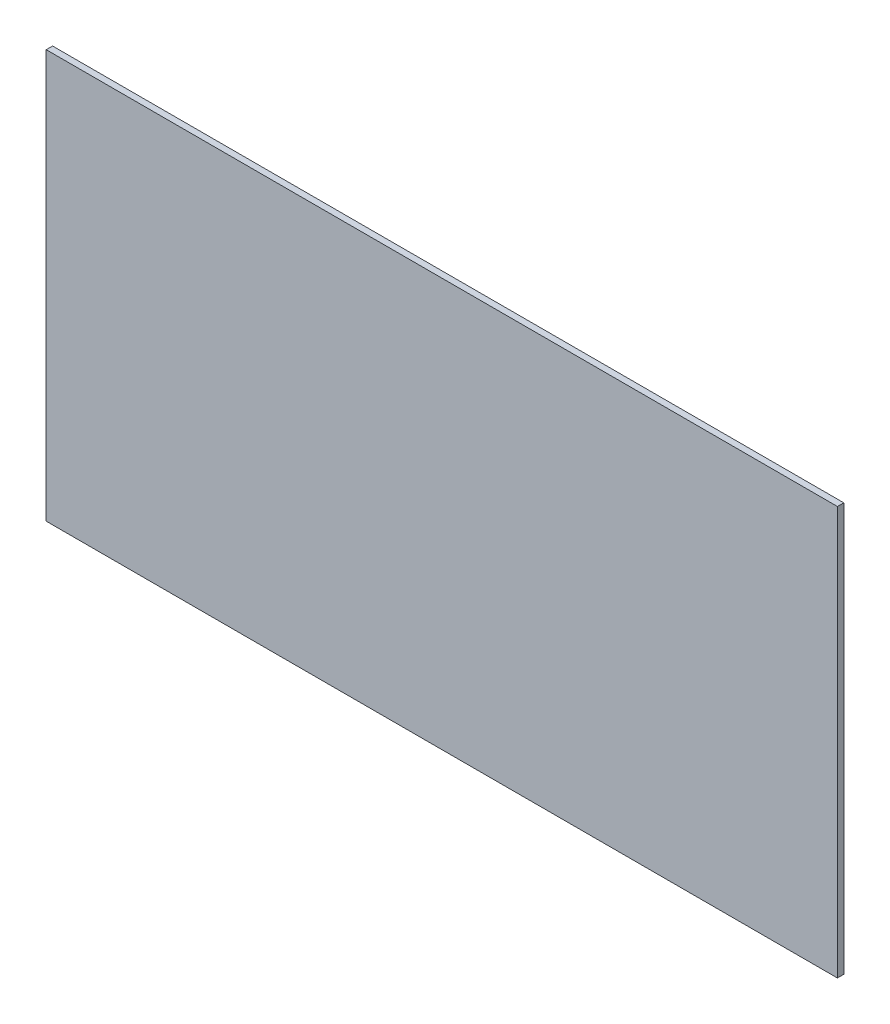
from build123d import *

# Parameters (mm, degrees)
SKETCH3_W           = 393.7
SKETCH3_H           = 203.2
BOSS_EXTRUDE1_DEPTH = 1.5875


with BuildPart() as part:
    # Sketch3 → Boss-Extrude1 (new, symmetric)
    with BuildSketch(Plane.XY):
        Rectangle(SKETCH3_W, SKETCH3_H)
    extrude(amount=BOSS_EXTRUDE1_DEPTH, both=True)


solid = part.part
